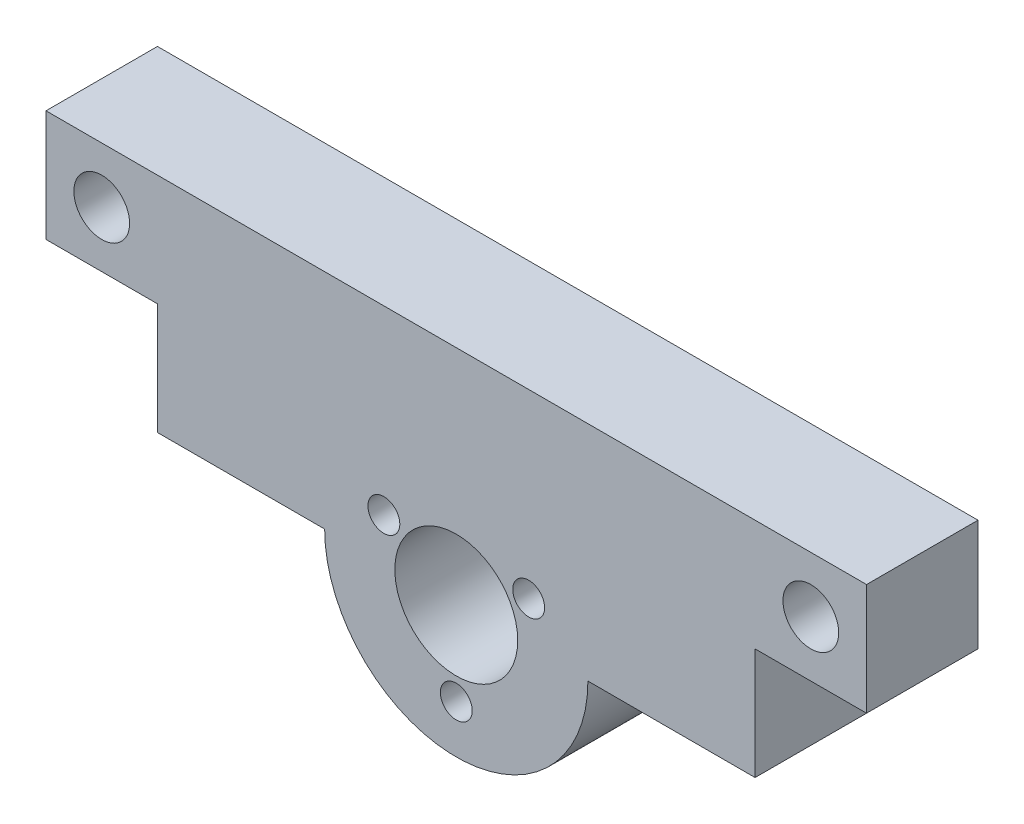
from build123d import *

# Parameters (mm, degrees)
SKETCH1_R           = 3.175
SKETCH1_R_2         = 1.8161
SKETCH1_R_3         = 7
BOSS_EXTRUDE1_DEPTH = 12.7


with BuildPart() as part:
    # Sketch1 → Boss-Extrude1 (new body)
    with BuildSketch(Plane.XY):
        with BuildLine():
            Line((-34.05, 9.525), (-15, 9.525))
            ThreePointArc((-15, 9.525), (0, -5.475), (15, 9.525))
            Line((15, 9.525), (34.05, 9.525))
            Line((34.05, 9.525), (34.05, 22.225))
            Line((34.05, 22.225), (46.75, 22.225))
            Line((46.75, 22.225), (46.75, 34.925))
            Line((46.75, 34.925), (-46.75, 34.925))
            Line((-46.75, 34.925), (-46.75, 22.225))
            Line((-46.75, 22.225), (-34.05, 22.225))
            Line((-34.05, 22.225), (-34.05, 9.525))
        make_face()
        with Locations((-40.4, 28.575)):
            Circle(SKETCH1_R, mode=Mode.SUBTRACT)
        with Locations((40.4, 28.575)):
            Circle(SKETCH1_R, mode=Mode.SUBTRACT)
        with Locations((8.248891971, 14.2875)):
            Circle(SKETCH1_R_2, mode=Mode.SUBTRACT)
        with Locations((-8.248891971, 14.2875)):
            Circle(SKETCH1_R_2, mode=Mode.SUBTRACT)
        Circle(SKETCH1_R_2, mode=Mode.SUBTRACT)
        with Locations((0, 9.525)):
            Circle(SKETCH1_R_3, mode=Mode.SUBTRACT)
    extrude(amount=BOSS_EXTRUDE1_DEPTH)


solid = part.part
